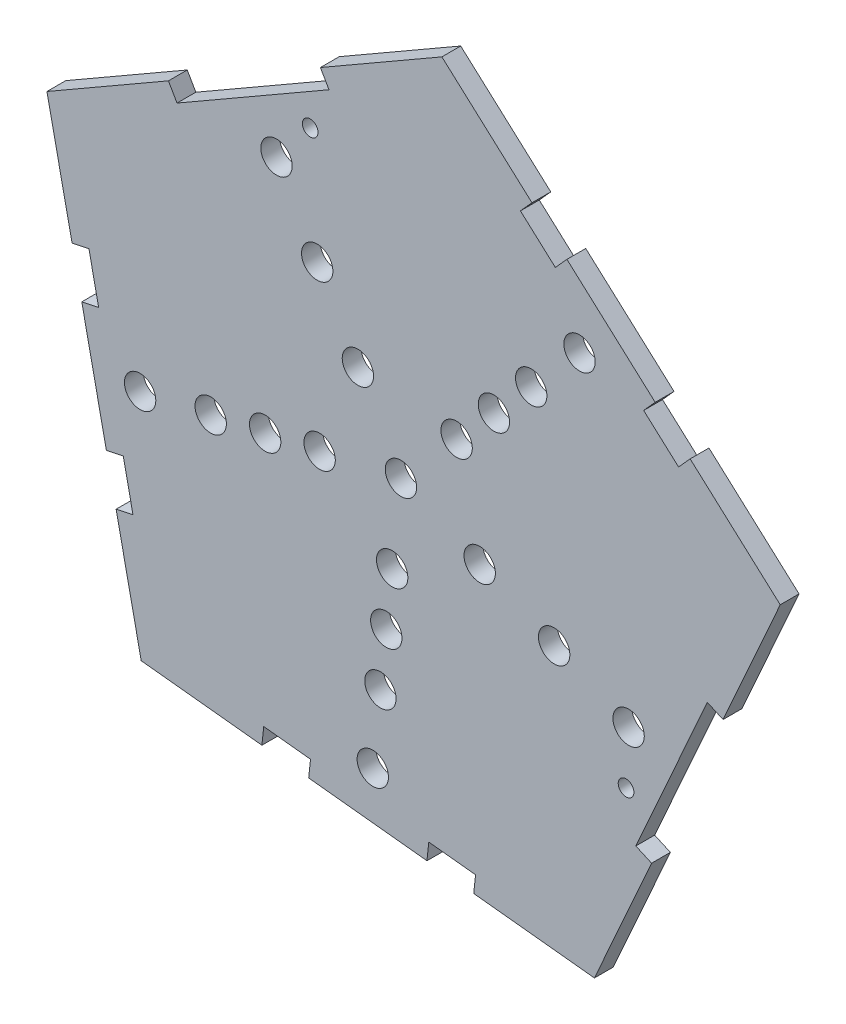
from build123d import *

# Parameters (mm, degrees)
BOSS_EXTRUDE1_DEPTH = 6
SKETCH2_R           = 5
CUT_EXTRUDE1_DEPTH  = 6
SKETCH11_R          = 4.999999998
CUT_EXTRUDE2_DEPTH  = 10
SKETCH12_R          = 5
SKETCH12_R_2        = 2.5
CUT_EXTRUDE3_DEPTH  = 10
CUT_EXTRUDE4_DEPTH  = 10
CUT_EXTRUDE5_DEPTH  = 10
BOSS_EXTRUDE2_START = -6
SKETCH14_R          = 2.5
BOSS_EXTRUDE2_DEPTH = 6
SKETCH14_3_R        = 2.5
CUT_EXTRUDE6_DEPTH  = 6


with BuildPart() as part:
    # Sketch1 → Boss-Extrude1 (new body)
    with BuildSketch(Plane.XY):
        Polygon((-82.808015356, -91.768584182), (61.688025962, -107.113154668), (120.9333121, 25.569013955), (13.052871288, 122.915674351), (-112.866193993, 50.397050544), align=None)
    extrude(amount=BOSS_EXTRUDE1_DEPTH)

    # Sketch2 → Cut-Extrude1 (cut)
    with BuildSketch(Plane.XY.offset(6)):
        Circle(SKETCH2_R)
    extrude(amount=-CUT_EXTRUDE1_DEPTH, mode=Mode.SUBTRACT)

    # Sketch11 → Cut-Extrude2 (cut)
    with BuildSketch(Plane.XY.offset(6)):
        with Locations((-6.54719671, -61.653339044)):
            Circle(SKETCH11_R)
        with Locations((-4.672797652, -44.002584721)):
            Circle(SKETCH11_R)
        with Locations((-2.798398593, -26.351830398)):
            Circle(SKETCH11_R)
        with Locations((-8.975995491, -84.524739011)):
            Circle(SKETCH11_R)
    cut_extrude2 = extrude(amount=-CUT_EXTRUDE2_DEPTH, mode=Mode.SUBTRACT)

    # Sketch12 → Cut-Extrude3 (cut)
    with BuildSketch(Plane.XY.offset(6)):
        with Locations((48.851207931, -21.813057641)):
            Circle(SKETCH12_R)
        with Locations((25.110433983, -11.212319348)):
            Circle(SKETCH12_R)
        with Locations((84.822429951, -20.352343286)):
            Circle(SKETCH12_R_2)
        with Locations((72.591981879, -32.413795933)):
            Circle(SKETCH12_R)
    cut_extrude3 = extrude(amount=-CUT_EXTRUDE3_DEPTH, mode=Mode.SUBTRACT)

    # Sketch11<3> → Cut-Extrude4 (cut)
    with BuildSketch(Plane.XY.offset(6)):
        Polygon((8.29449613, -101.443097727), (8.875295839, -95.973849909), (23.791426251, -97.557849113), (23.210626543, -103.027096932), align=None)
        Polygon((-29.414485521, -97.438641123), (-28.833685813, -91.969393305), (-43.749816225, -90.3853941), (-44.330615934, -95.854641919), align=None)
    cut_extrude4 = extrude(amount=-CUT_EXTRUDE4_DEPTH, mode=Mode.SUBTRACT)

    # Mirror3: Cut-Extrude2 across plane
    add(cut_extrude2.mirror(Plane(origin=(0, 0, 0), x_dir=(0, 0, 1), z_dir=(-0.4077207035645653, -0.9131066903077734, 0))), mode=Mode.SUBTRACT)

    # Mirror4: Cut-Extrude3 across plane
    add(cut_extrude3.mirror(Plane(origin=(0, 0, 0), x_dir=(0, 0, 1), z_dir=(0.742423441529948, -0.6699309169360882, 0))), mode=Mode.SUBTRACT)

    # Mirror5: Cut-Extrude2 across plane
    add(cut_extrude2.mirror(Plane(origin=(0, 0, 0), x_dir=(0, 0, 1), z_dir=(0.742423441529948, -0.6699309169360882, 0))), mode=Mode.SUBTRACT)

    # Mirror6: Cut-Extrude4 across plane
    add(cut_extrude4.mirror(Plane(origin=(0, 0, 0), x_dir=(0, 0, 1), z_dir=(-0.4077207035645653, -0.9131066903077734, 0))), mode=Mode.SUBTRACT)

    # Mirror7: Cut-Extrude4 across plane
    add(cut_extrude4.mirror(Plane(origin=(0, 0, 0), x_dir=(0, 0, 1), z_dir=(0.742423441529948, -0.6699309169360882, 0))), mode=Mode.SUBTRACT)

    # Sketch13 → Cut-Extrude5 (cut)
    with BuildSketch(Plane.XY.offset(6)):
        Polygon((79.910592339, -66.30299436), (102.710745723, -15.241146353), (97.688658926, -12.998682483), (74.888505542, -64.060530491), align=None)
    cut_extrude5 = extrude(amount=-CUT_EXTRUDE5_DEPTH, mode=Mode.SUBTRACT)

    # Mirror8: Cut-Extrude5 across plane
    add(cut_extrude5.mirror(Plane(origin=(0, 0, 0), x_dir=(0, 0, 1), z_dir=(0.742423441529948, -0.6699309169360882, 0))), mode=Mode.SUBTRACT)

    # Sketch14 → Boss-Extrude2 (add)
    with BuildSketch(Plane(origin=(0, 0, 0), x_dir=(-1, 0, 0), z_dir=(0, 0, -1)).offset(BOSS_EXTRUDE2_START)):
        with Locations((-84.822429951, -20.352343286)):
            Circle(SKETCH14_R)
    extrude(amount=BOSS_EXTRUDE2_DEPTH)

    # Sketch14<3> → Cut-Extrude6 (cut)
    with BuildSketch(Plane(origin=(0, 0, 0), x_dir=(-1, 0, 0), z_dir=(0, 0, -1))):
        with Locations((-71.775367437, -49.571757376)):
            Circle(SKETCH14_3_R)
    extrude(amount=-CUT_EXTRUDE6_DEPTH, mode=Mode.SUBTRACT)


solid = part.part
